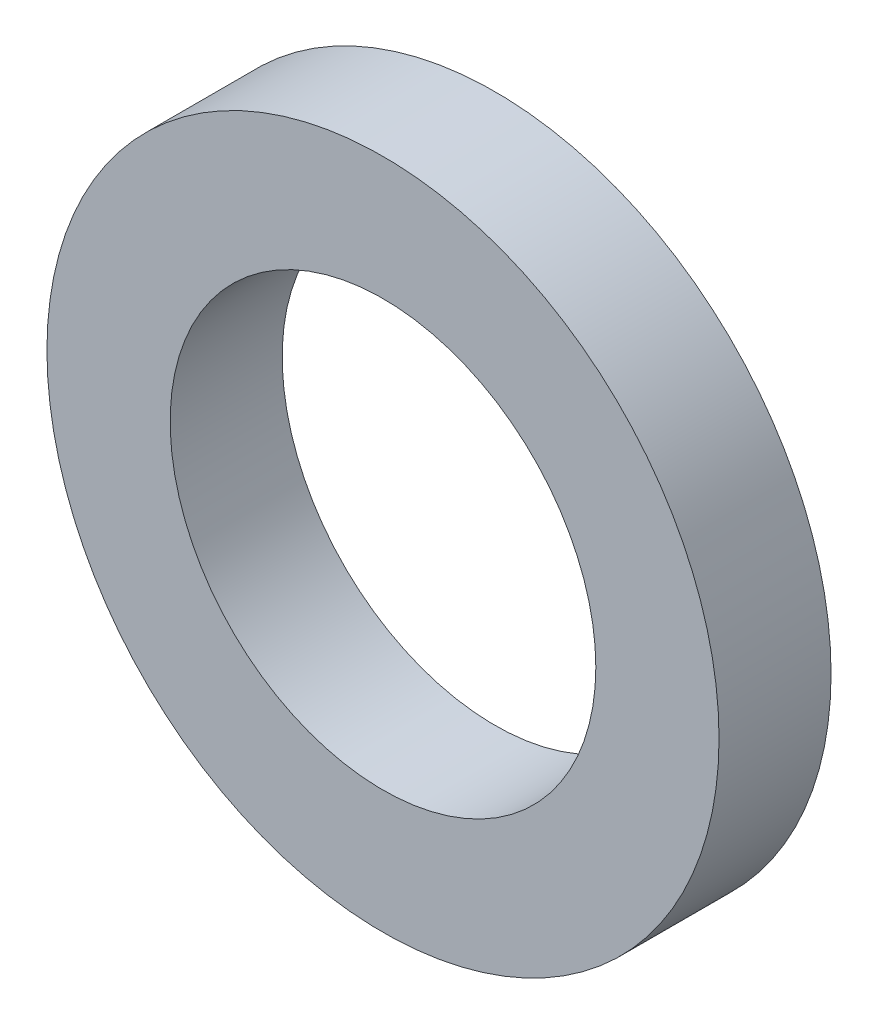
from build123d import *

# Parameters (mm, degrees)
SKETCH2_R           = 3
BOSS_EXTRUDE1_DEPTH = 1
SKETCH3_R           = 1.9
CUT_EXTRUDE1_DEPTH  = 1


with BuildPart() as part:
    # Sketch2 → Boss-Extrude1 (new body)
    with BuildSketch(Plane.XY):
        Circle(SKETCH2_R)
    extrude(amount=BOSS_EXTRUDE1_DEPTH)

    # Sketch3 → Cut-Extrude1 (cut)
    with BuildSketch(Plane.XY.offset(1)):
        Circle(SKETCH3_R)
    extrude(amount=-CUT_EXTRUDE1_DEPTH, mode=Mode.SUBTRACT)


solid = part.part
